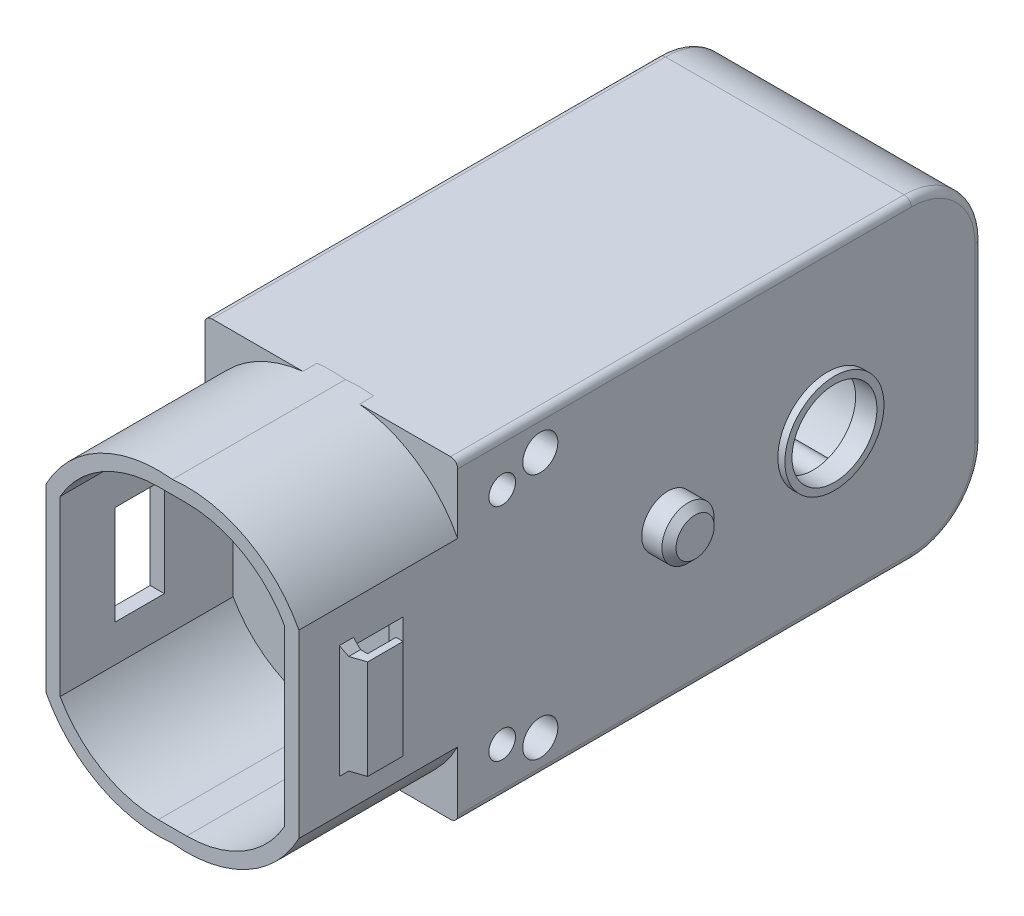
from build123d import *

# Parameters (mm, degrees)
BOSS_EXTRUDE1_DEPTH  = 11.2
BOSS_EXTRUDE2_START  = 1
BOSS_EXTRUDE2_DEPTH  = 1
BOSS_EXTRUDE4_DEPTH  = 36
SKETCH5_W            = 8.920001513
SKETCH5_H            = 22.167921158
BOSS_EXTRUDE6_DEPTH  = 2
FILLET2_R            = 5
SKETCH6_W            = 1.4
SKETCH6_H            = 5
BOSS_EXTRUDE7_DEPTH  = 4.8
SKETCH7_R            = 1.38
CUT_EXTRUDE1_DEPTH   = 4.8
SKETCH8_R            = 3.495
SKETCH8_R_2          = 2.995
BOSS_EXTRUDE8_DEPTH  = 0.5
CUT_EXTRUDE2_START   = -7.5
SKETCH9_R            = 2.995
CUT_EXTRUDE2_DEPTH   = 7.5
CHAMFER1_SIZE        = 1
SKETCH10_R           = 1.845
BOSS_EXTRUDE9_DEPTH  = 1.92
CHAMFER2_SIZE        = 0.5
SKETCH11_R           = 1.5
CUT_EXTRUDE3_DEPTH   = 1.92
SKETCH12_R           = 1.15
CUT_EXTRUDE4_DEPTH   = 1.92
BOSS_EXTRUDE13_DEPTH = 0.5
SKETCH14_W           = 3.5
SKETCH14_H           = 7
CUT_EXTRUDE6_DEPTH   = 5.5
BOSS_EXTRUDE14_DEPTH = 7
SKETCH16_W           = 0.5
SKETCH16_H           = 7
BOSS_EXTRUDE16_DEPTH = 2
CHAMFER3_SIZE        = 0.5
SKETCH20_R           = 0.5
BOSS_EXTRUDE19_DEPTH = 15
BOSS_EXTRUDE23_START = -1
SKETCH21_R           = 1.5
SKETCH21_R_2         = 1.237971005
SKETCH21_R_3         = 1.15
SKETCH21_R_4         = 0.940138742
BOSS_EXTRUDE23_DEPTH = 1
SKETCH21_2_R         = 1.5
SKETCH21_2_R_2       = 1.237971005
SKETCH21_2_R_3       = 1.15
SKETCH21_2_R_4       = 0.940138742
BOSS_EXTRUDE24_DEPTH = 8
SKETCH22_R           = 0.8
SKETCH22_R_2         = 0.5
BOSS_EXTRUDE25_DEPTH = 8
FILLET4_R            = 0.5


with BuildPart() as part:
    # Sketch1 → Boss-Extrude1 (new body)
    with BuildSketch(Plane.XY):
        with BuildLine():
            Line((0, 11.115), (0, 10.171175948))
            Line((0, 10.171175948), (-1, 10.171175948))
            ThreePointArc((-1, 10.171175948), (-5.011187662, 9.081675078), (-7.920001513, 6.112594314))
            Line((-7.920001513, 6.112594314), (-7.920001513, -6.112594314))
            ThreePointArc((-7.920001513, -6.112594314), (-5.011187662, -9.081675078), (-1, -10.171175948))
            Line((-1, -10.171175948), (0, -10.171175948))
            Line((0, -10.171175948), (0, -11.115))
            ThreePointArc((0, -11.115), (-5.196692773, -10.123430296), (-8.920001513, -6.365))
            Line((-8.920001513, -6.365), (-8.920001513, 6.365))
            ThreePointArc((-8.920001513, 6.365), (-5.196692773, 10.123430296), (0, 11.115))
        make_face()
    extrude(amount=BOSS_EXTRUDE1_DEPTH)

    # Sketch2 → Boss-Extrude2 (add)
    with BuildSketch(Plane(origin=(0, 0, 0), x_dir=(-1, 0, 0), z_dir=(0, 0, -1)).offset(BOSS_EXTRUDE2_START)):
        with BuildLine():
            Line((2, 11.115), (8.920001513, 11.115))
            Line((8.920001513, 11.115), (8.920001513, -11.052921158))
            Line((8.920001513, -11.052921158), (2.44835684, -11.052921158))
            ThreePointArc((2.44835684, -11.052921158), (1.226317056, -11.16830724), (0, -11.115))
            Line((0, -11.115), (0, -10.171175948))
            Line((0, -10.171175948), (1, -10.171175948))
            ThreePointArc((1, -10.171175948), (5.011187662, -9.081675078), (7.920001513, -6.112594314))
            Line((7.920001513, -6.112594314), (7.920001513, 6.112594314))
            ThreePointArc((7.920001513, 6.112594314), (5.011187662, 9.081675078), (1, 10.171175948))
            Line((1, 10.171175948), (0, 10.171175948))
            Line((0, 10.171175948), (0, 11.115))
            ThreePointArc((0, 11.115), (1, 11.171175948), (2, 11.115))
        make_face()
    extrude(amount=-BOSS_EXTRUDE2_DEPTH)

    # Sketch4 → Boss-Extrude4 (add)
    with BuildSketch(Plane(origin=(0, 0, -1), x_dir=(-1, 0, 0), z_dir=(0, 0, -1))):
        Polygon((8.920001513, 11.115), (0, 11.115), (0, 10.115), (1, 10.115), (7.920001513, 10.115), (7.920001513, -10.052921158), (1, -10.052921158), (0, -10.052921158), (0, -11.052921158), (8.920001513, -11.052921158), align=None)
    extrude(amount=BOSS_EXTRUDE4_DEPTH)

    # Sketch5 → Boss-Extrude6 (add)
    with BuildSketch(Plane(origin=(0, 0, -37), x_dir=(-1, 0, 0), z_dir=(0, 0, -1))):
        with Locations((4.460000757, 0.031039421)):
            Rectangle(SKETCH5_W, SKETCH5_H)
    extrude(amount=-BOSS_EXTRUDE6_DEPTH)

    # Fillet2
    fillet2_edges = [part.edges().sort_by_distance(p)[0] for p in [
        (-3.960000757, -10.052921158, -35),
        (-3.960000757, 10.115, -35),
        (-4.460000757, -11.052921158, -37),
        (-4.460000757, 11.115, -37),
    ]]
    fillet(fillet2_edges, radius=FILLET2_R)

    # Sketch6 → Boss-Extrude7 (add)
    with BuildSketch(Plane(origin=(0, 0, -37), x_dir=(-1, 0, 0), z_dir=(0, 0, -1))):
        with Locations((0.7, 0)):
            Rectangle(SKETCH6_W, SKETCH6_H)
    extrude(amount=BOSS_EXTRUDE7_DEPTH)

    # Sketch7 → Cut-Extrude1 (cut)
    with BuildSketch(Plane.ZY.offset(1.4)):
        with Locations((-39.4, 0)):
            Circle(SKETCH7_R)
    extrude(amount=-CUT_EXTRUDE1_DEPTH, mode=Mode.SUBTRACT)

    # Sketch8 → Boss-Extrude8 (add)
    with BuildSketch(Plane.ZY.offset(8.920001513)):
        with Locations((-26.08, 0)):
            Circle(SKETCH8_R)
        with Locations((-26.08, 0)):
            Circle(SKETCH8_R_2, mode=Mode.SUBTRACT)
    extrude(amount=BOSS_EXTRUDE8_DEPTH)

    # Sketch9 → Cut-Extrude2 (cut)
    with BuildSketch(Plane.ZY.offset(8.920001513).offset(CUT_EXTRUDE2_START)):
        with Locations((-26.08, 0)):
            Circle(SKETCH9_R)
    extrude(amount=CUT_EXTRUDE2_DEPTH, mode=Mode.SUBTRACT)

    # Chamfer1
    chamfer1_edges = [part.edges().sort_by_distance(p)[0] for p in [
        (-0.7, -2.5, -37),
        (-0.7, 2.5, -37),
    ]]
    chamfer(chamfer1_edges, length=CHAMFER1_SIZE)

    # Sketch10 → Boss-Extrude9 (add)
    with BuildSketch(Plane.ZY.offset(8.920001513)):
        with Locations((-14.83, 0)):
            Circle(SKETCH10_R)
    extrude(amount=BOSS_EXTRUDE9_DEPTH)

    # Chamfer2
    chamfer2_edges = [part.edges().sort_by_distance(p)[0] for p in [
        (-10.840001513, 0, -16.675),
    ]]
    chamfer(chamfer2_edges, length=CHAMFER2_SIZE)

    # Sketch11 → Cut-Extrude3 (cut)
    with BuildSketch(Plane.ZY.offset(8.920001513)):
        with Locations((-5.83, 8.71)):
            Circle(SKETCH11_R)
        with Locations((-5.83, -8.71)):
            Circle(SKETCH11_R)
    extrude(amount=-CUT_EXTRUDE3_DEPTH, mode=Mode.SUBTRACT)

    # Sketch12 → Cut-Extrude4 (cut)
    with BuildSketch(Plane.ZY.offset(8.920001513)):
        with Locations((-3.140037022, 7.781512681)):
            Circle(SKETCH12_R)
        with Locations((-3.140037022, -7.781512681)):
            Circle(SKETCH12_R)
    extrude(amount=-CUT_EXTRUDE4_DEPTH, mode=Mode.SUBTRACT)

    # Sketch13 → Boss-Extrude13 (add)
    with BuildSketch(Plane(origin=(0, 0, -1), x_dir=(-1, 0, 0), z_dir=(0, 0, -1))):
        with BuildLine():
            Line((7.920001513, 10.115), (0, 10.115))
            Line((0, 10.115), (0, 2.5))
            ThreePointArc((0, 2.5), (2.5, 0), (0, -2.5))
            Line((0, -2.5), (0, -10.115))
            Line((0, -10.115), (0, -10.171175948))
            Line((0, -10.171175948), (0.5, -10.171175948))
            Line((0.5, -10.171175948), (7.920001513, -10.171175948))
            Line((7.920001513, -10.171175948), (7.920001513, 10.115))
        make_face()
    extrude(amount=BOSS_EXTRUDE13_DEPTH)

    # Sketch14 → Cut-Extrude6 (cut)
    with BuildSketch(Plane.ZY.offset(8.920001513)):
        with Locations((5.6, 0)):
            Rectangle(SKETCH14_W, SKETCH14_H)
    extrude(amount=-CUT_EXTRUDE6_DEPTH, mode=Mode.SUBTRACT)

    # Sketch15 → Boss-Extrude14 (add)
    with BuildSketch(Plane.XZ.offset(-3.5)):
        Polygon((-8.920001513, 7.35), (-10.420001513, 7.35), (-10.420001513, 7.85), (-8.920001513, 8.35), align=None)
    extrude(amount=BOSS_EXTRUDE14_DEPTH)

    # Sketch16 → Boss-Extrude16 (add)
    with BuildSketch(Plane(origin=(0, 0, 7.35), x_dir=(-1, 0, 0), z_dir=(0, 0, -1))):
        with Locations((10.170001513, 0)):
            Rectangle(SKETCH16_W, SKETCH16_H)
    extrude(amount=BOSS_EXTRUDE16_DEPTH)

    # Chamfer3
    chamfer3_edges = [part.edges().sort_by_distance(p)[0] for p in [
        (-8.920001513, -3.5, 7.85),
        (-8.920001513, 3.5, 7.85),
    ]]
    chamfer(chamfer3_edges, length=CHAMFER3_SIZE)

    # Sketch20 → Boss-Extrude19 (add)
    with BuildSketch(Plane(origin=(-7.920001513, 0, 0), x_dir=(0, 0, -1), z_dir=(1, 0, 0))):
        with Locations((16.425, 0)):
            Circle(SKETCH20_R)
    extrude(amount=BOSS_EXTRUDE19_DEPTH)

    # Sketch21 → Boss-Extrude23 (add)
    # profile 1 of 4: a face of its own
    with BuildSketch(Plane(origin=(-7.920001513, 0, 0), x_dir=(0, 0, -1), z_dir=(1, 0, 0)).offset(BOSS_EXTRUDE23_START)):
        with Locations((5.83, 8.71)):
            Circle(SKETCH21_R)
        with Locations((5.83, 8.71)):
            Circle(SKETCH21_R_2, mode=Mode.SUBTRACT)
    # profile 2 of 4: a face of its own
    with BuildSketch(Plane(origin=(-7.920001513, 0, 0), x_dir=(0, 0, -1), z_dir=(1, 0, 0)).offset(BOSS_EXTRUDE23_START)):
        with Locations((3.140037022, 7.781512681)):
            Circle(SKETCH21_R_3)
        with Locations((3.140037022, 7.781512681)):
            Circle(SKETCH21_R_4, mode=Mode.SUBTRACT)
    # profile 3 of 4: a face of its own
    with BuildSketch(Plane(origin=(-7.920001513, 0, 0), x_dir=(0, 0, -1), z_dir=(1, 0, 0)).offset(BOSS_EXTRUDE23_START)):
        with Locations((3.140037022, -7.781512681)):
            Circle(SKETCH21_R_3)
        with Locations((3.140037022, -7.781512681)):
            Circle(SKETCH21_R_4, mode=Mode.SUBTRACT)
    # profile 4 of 4: a face of its own
    with BuildSketch(Plane(origin=(-7.920001513, 0, 0), x_dir=(0, 0, -1), z_dir=(1, 0, 0)).offset(BOSS_EXTRUDE23_START)):
        with Locations((5.83, -8.71)):
            Circle(SKETCH21_R)
        with Locations((5.83, -8.71)):
            Circle(SKETCH21_R_2, mode=Mode.SUBTRACT)
    extrude(amount=BOSS_EXTRUDE23_DEPTH)

    # Sketch21<2> → Boss-Extrude24 (add)
    # profile 1 of 4: a face of its own
    with BuildSketch(Plane(origin=(-7.920001513, 0, 0), x_dir=(0, 0, -1), z_dir=(1, 0, 0))):
        with Locations((5.83, 8.71)):
            Circle(SKETCH21_2_R)
        with Locations((5.83, 8.71)):
            Circle(SKETCH21_2_R_2, mode=Mode.SUBTRACT)
    # profile 2 of 4: a face of its own
    with BuildSketch(Plane(origin=(-7.920001513, 0, 0), x_dir=(0, 0, -1), z_dir=(1, 0, 0))):
        with Locations((3.140037022, 7.781512681)):
            Circle(SKETCH21_2_R_3)
        with Locations((3.140037022, 7.781512681)):
            Circle(SKETCH21_2_R_4, mode=Mode.SUBTRACT)
    # profile 3 of 4: a face of its own
    with BuildSketch(Plane(origin=(-7.920001513, 0, 0), x_dir=(0, 0, -1), z_dir=(1, 0, 0))):
        with Locations((3.140037022, -7.781512681)):
            Circle(SKETCH21_2_R_3)
        with Locations((3.140037022, -7.781512681)):
            Circle(SKETCH21_2_R_4, mode=Mode.SUBTRACT)
    # profile 4 of 4: a face of its own
    with BuildSketch(Plane(origin=(-7.920001513, 0, 0), x_dir=(0, 0, -1), z_dir=(1, 0, 0))):
        with Locations((5.83, -8.71)):
            Circle(SKETCH21_2_R)
        with Locations((5.83, -8.71)):
            Circle(SKETCH21_2_R_2, mode=Mode.SUBTRACT)
    extrude(amount=BOSS_EXTRUDE24_DEPTH)

    # Sketch22 → Boss-Extrude25 (add)
    # profile 1 of 4: a face of its own
    with BuildSketch(Plane(origin=(-7.920001513, 0, 0), x_dir=(0, 0, -1), z_dir=(1, 0, 0))):
        with Locations((17.526449978, 9.081390514)):
            Circle(SKETCH22_R)
        with Locations((17.526449978, 9.081390514)):
            Circle(SKETCH22_R_2, mode=Mode.SUBTRACT)
    # profile 2 of 4: a face of its own
    with BuildSketch(Plane(origin=(-7.920001513, 0, 0), x_dir=(0, 0, -1), z_dir=(1, 0, 0))):
        with Locations((31.797803684, 8.592263442)):
            Circle(SKETCH22_R)
        with Locations((31.797803684, 8.592263442)):
            Circle(SKETCH22_R_2, mode=Mode.SUBTRACT)
    # profile 3 of 4: a face of its own
    with BuildSketch(Plane(origin=(-7.920001513, 0, 0), x_dir=(0, 0, -1), z_dir=(1, 0, 0))):
        with Locations((31.797803684, -8.592263442)):
            Circle(SKETCH22_R)
        with Locations((31.797803684, -8.592263442)):
            Circle(SKETCH22_R_2, mode=Mode.SUBTRACT)
    # profile 4 of 4: a face of its own
    with BuildSketch(Plane(origin=(-7.920001513, 0, 0), x_dir=(0, 0, -1), z_dir=(1, 0, 0))):
        with Locations((17.526449978, -9.081390514)):
            Circle(SKETCH22_R)
        with Locations((17.526449978, -9.081390514)):
            Circle(SKETCH22_R_2, mode=Mode.SUBTRACT)
    extrude(amount=BOSS_EXTRUDE25_DEPTH)

    # Mirror7: part across plane


with BuildPart() as part_1:
    add(part.part)
    add(part.part.mirror(Plane(origin=(0, 0, 0), x_dir=(0, 0, 1), z_dir=(1, 0, 0))))

    # Fillet4
    fillet4_edges = [part_1.edges().sort_by_distance(p)[0] for p in [
        (-8.920001513, -11.052921158, -16),
        (-8.920001513, -9.588455064, -35.535533906),
        (-8.920001513, 0.031039421, -37),
        (-8.920001513, 9.650533906, -35.535533906),
        (8.920001513, -11.052921158, -16),
        (8.920001513, -9.588455064, -35.535533906),
        (8.920001513, 0.031039421, -37),
        (8.920001513, 9.650533906, -35.535533906),
        (-8.920001513, 11.115, -16),
        (8.920001513, 11.115, -16),
    ]]
    fillet(fillet4_edges, radius=FILLET4_R)


solid = part_1.part
